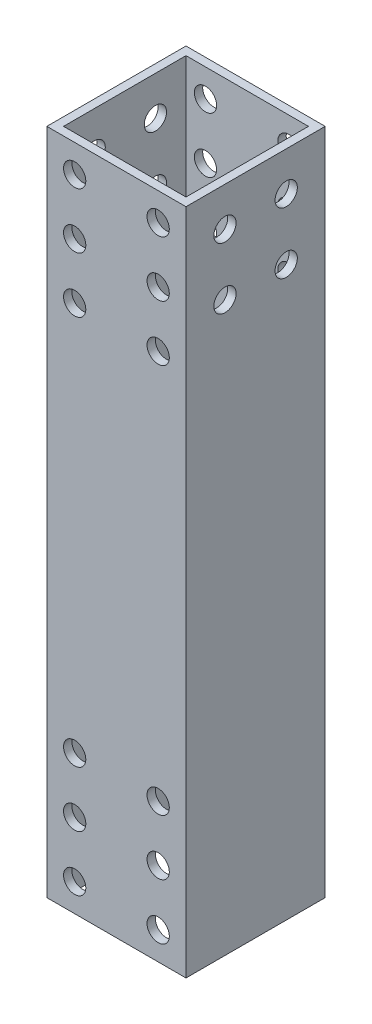
from build123d import *

# Parameters (mm, degrees)
BOSS_EXTRUDE1_DEPTH      = 60
BOSS_EXTRUDE1_DEPTH_BACK = 60
SKETCH1_W                = 25
SKETCH1_H                = 25
SKETCH1_W_2              = 22
SKETCH1_H_2              = 22
SKETCH2_R                = 2
CUT_EXTRUDE1_DEPTH       = 25
SKETCH3_R                = 2
CUT_EXTRUDE2_DEPTH       = 25


with BuildPart() as part:
    # Sketch1 → Boss-Extrude1 (new, two sides: drawn at the far end of the back side and taken through both)
    with BuildSketch(Plane(origin=(0, 0, 0), x_dir=(1, 0, 0), z_dir=(0, 1, 0)).offset(-BOSS_EXTRUDE1_DEPTH_BACK)):
        Rectangle(SKETCH1_W, SKETCH1_H)
        Rectangle(SKETCH1_W_2, SKETCH1_H_2, mode=Mode.SUBTRACT)
    extrude(amount=BOSS_EXTRUDE1_DEPTH + BOSS_EXTRUDE1_DEPTH_BACK)

    # Sketch2 → Cut-Extrude1 (cut)
    with BuildSketch(Plane(origin=(0, 0, -12.5), x_dir=(-1, 0, 0), z_dir=(0, 0, -1))):
        with Locations((7.5, 55)):
            Circle(SKETCH2_R)
        with Locations((7.5, 45)):
            Circle(SKETCH2_R)
        with Locations((-7.5, 55)):
            Circle(SKETCH2_R)
        with Locations((-7.5, 45)):
            Circle(SKETCH2_R)
        with Locations((7.5, 35)):
            Circle(SKETCH2_R)
        with Locations((-7.5, 35)):
            Circle(SKETCH2_R)
    cut_extrude1 = extrude(amount=-CUT_EXTRUDE1_DEPTH, mode=Mode.SUBTRACT)

    # Mirror1: Cut-Extrude1 across plane
    add(cut_extrude1.mirror(Plane.ZX), mode=Mode.SUBTRACT)

    # Sketch3 → Cut-Extrude2 (cut)
    with BuildSketch(Plane(origin=(12.5, 0, 0), x_dir=(0, 0, -1), z_dir=(1, 0, 0))):
        with Locations((5.5, 53)):
            Circle(SKETCH3_R)
        with Locations((5.5, 42)):
            Circle(SKETCH3_R)
        with Locations((-5.5, 53)):
            Circle(SKETCH3_R)
        with Locations((-5.5, 42)):
            Circle(SKETCH3_R)
    extrude(amount=-CUT_EXTRUDE2_DEPTH, mode=Mode.SUBTRACT)


solid = part.part
